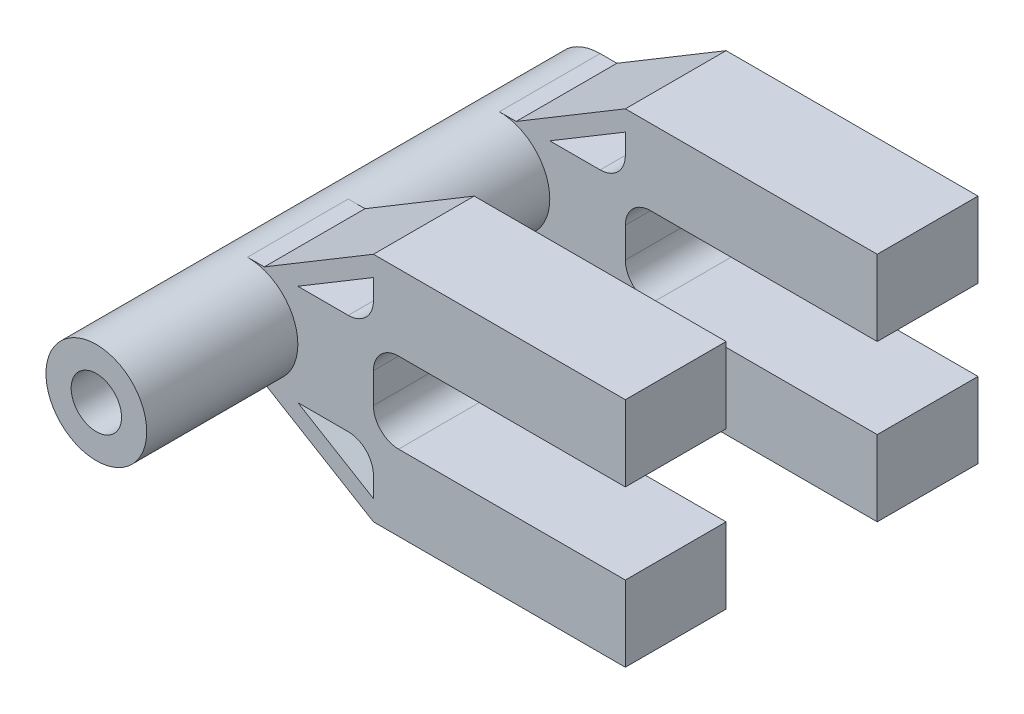
from build123d import *

# Parameters (mm, degrees)
SKETCH_1_R          = 20
EXTRUDE_1_DEPTH     = 200
SKETCH_2_W          = 40
SKETCH_2_H          = 40
EXTRUDE_2_DEPTH     = 50
SKETCH_3_W          = 100
SKETCH_3_H          = 30
EXTRUDE_3_DEPTH     = 40
SKETCH_4_W          = 100
SKETCH_4_H          = 30
EXTRUDE_4_DEPTH     = 40
FILLET_1_R          = 10
SKETCH_10_R         = 10
CUT_EXTRUDE_1_DEPTH = 20
EXTRUDE_6_DEPTH     = 20
EXTRUDE_7_DEPTH     = 20


with BuildPart() as part:
    # 스케치1 → 보스-돌출1 (new body)
    with BuildSketch(Plane.XY):
        Circle(SKETCH_1_R)
    extrude(amount=EXTRUDE_1_DEPTH)

    # 스케치2 → 보스-돌출2 (add)
    with BuildSketch(Plane(origin=(0, 0, 0), x_dir=(0, 0, -1), z_dir=(1, 0, 0))):
        with Locations((-20, 0)):
            Rectangle(SKETCH_2_W, SKETCH_2_H)
        with Locations((-120, 0)):
            Rectangle(SKETCH_2_W, SKETCH_2_H)
    extrude(amount=EXTRUDE_2_DEPTH)

    # 스케치3 → 보스-돌출3 (add)
    with BuildSketch(Plane(origin=(0, 0, 0), x_dir=(-1, 0, 0), z_dir=(0, 0, -1))):
        with Locations((-100, -31)):
            Rectangle(SKETCH_3_W, SKETCH_3_H)
        with Locations((-100, 31)):
            Rectangle(SKETCH_3_W, SKETCH_3_H)
    extrude(amount=-EXTRUDE_3_DEPTH)

    # 스케치4 → 보스-돌출4 (add)
    with BuildSketch(Plane(origin=(0, 0, 100), x_dir=(-1, 0, 0), z_dir=(0, 0, -1))):
        with Locations((-100, -31)):
            Rectangle(SKETCH_4_W, SKETCH_4_H)
        with Locations((-100, 31)):
            Rectangle(SKETCH_4_W, SKETCH_4_H)
    extrude(amount=-EXTRUDE_4_DEPTH)

    # 필렛1
    fillet_1_edges = [part.edges().sort_by_distance(p)[0] for p in [
        (50, -20, 20),
        (50, 20, 120),
        (50, -20, 120),
        (50, -16, 20),
        (50, 16, 20),
        (50, -16, 120),
        (50, 16, 120),
        (50, 20, 20),
    ]]
    fillet(fillet_1_edges, radius=FILLET_1_R)

    # 스케치10 → 컷-돌출1 (cut)
    with BuildSketch(Plane.XY.offset(200)):
        Circle(SKETCH_10_R)
    extrude(amount=-CUT_EXTRUDE_1_DEPTH, mode=Mode.SUBTRACT)

    # 스케치11 → 보스-돌출6 (add, symmetric)
    with BuildSketch(Plane.XY.offset(20)):
        Polygon((20, 20), (50, 38), (50, 46), (6.666666667, 20), align=None)
        Polygon((20, -20), (50, -38), (50, -46), (6.666666667, -20), align=None)
    extrude(amount=EXTRUDE_6_DEPTH, both=True)

    # 스케치13 → 보스-돌출7 (add, symmetric)
    with BuildSketch(Plane.XY.offset(120)):
        Polygon((20, 20), (50, 38), (50, 46), (6.666666667, 20), align=None)
        Polygon((20, -20), (6.666666667, -20), (50, -46), (50, -38), align=None)
    extrude(amount=EXTRUDE_7_DEPTH, both=True)


solid = part.part
